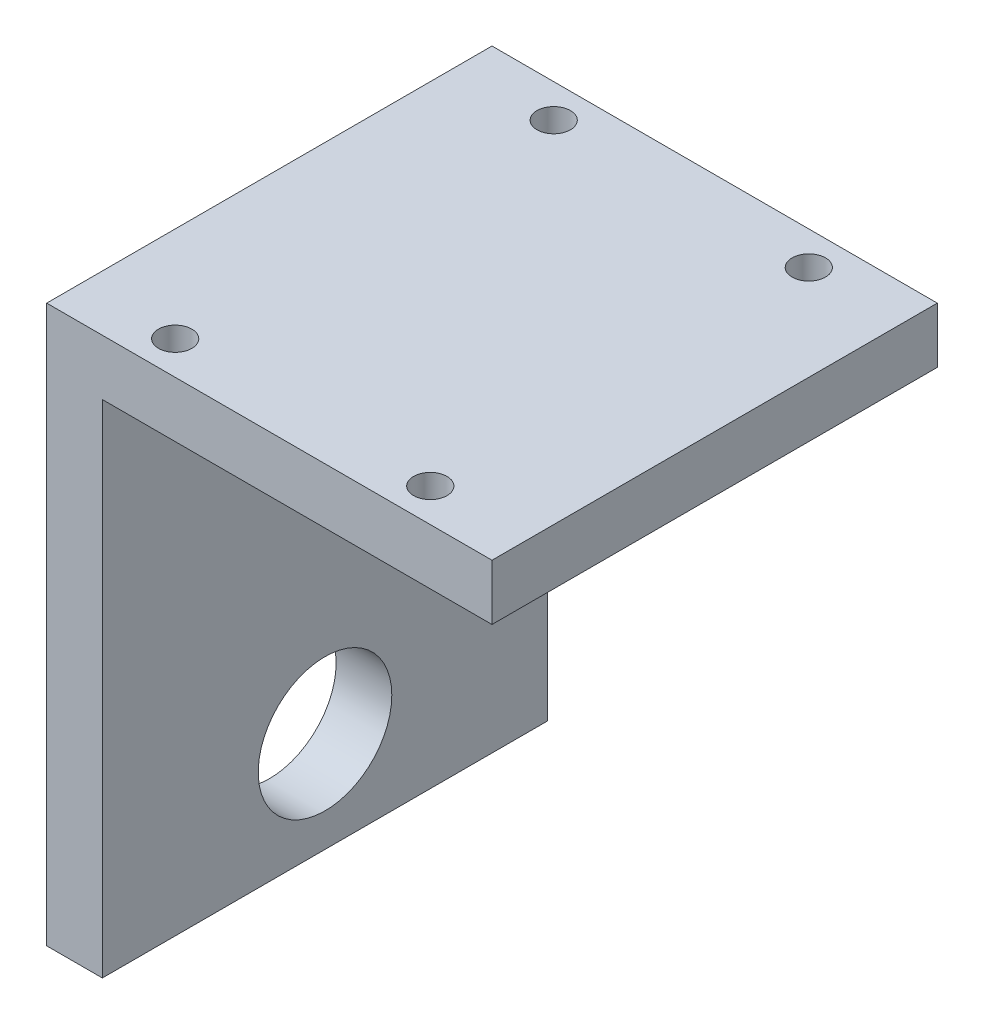
from build123d import *

# Parameters (mm, degrees)
SKETCH1_W           = 40
SKETCH1_H           = 40
BOSS_EXTRUDE1_DEPTH = 5
SKETCH2_W           = 5
SKETCH2_H           = 40
BOSS_EXTRUDE4_DEPTH = 45
SKETCH6_R           = 6
CUT_EXTRUDE5_DEPTH  = 61.415229868
SKETCH7_R           = 1.5
CUT_EXTRUDE6_DEPTH  = 58.445626465


with BuildPart() as part:
    # Sketch1 → Boss-Extrude1 (new body)
    with BuildSketch(Plane(origin=(0, 0, 0), x_dir=(1, 0, 0), z_dir=(0, 1, 0))):
        Rectangle(SKETCH1_W, SKETCH1_H)
    extrude(amount=BOSS_EXTRUDE1_DEPTH)

    # Sketch2 → Boss-Extrude4 (add)
    with BuildSketch(Plane.XZ):
        with Locations((-17.5, 0)):
            Rectangle(SKETCH2_W, SKETCH2_H)
    extrude(amount=BOSS_EXTRUDE4_DEPTH)

    # Sketch6 → Cut-Extrude5 (cut, through all)
    with BuildSketch(Plane(origin=(-15, 0, 0), x_dir=(0, 0, -1), z_dir=(1, 0, 0))):
        with Locations((0, -36)):
            Circle(SKETCH6_R)
    extrude(amount=-CUT_EXTRUDE5_DEPTH, mode=Mode.SUBTRACT)

    # Sketch7 → Cut-Extrude6 (cut, through all)
    with BuildSketch(Plane(origin=(0, 5, 0), x_dir=(1, 0, 0), z_dir=(0, 1, 0))):
        with Locations(Location((-11.456996051, 17, 0), (0, 0, 270))):
            Circle(SKETCH7_R)
        with Locations(Location((11.456996051, 17, 0), (0, 0, 270))):
            Circle(SKETCH7_R)
        with Locations(Location((11.456996051, -17, 0), (0, 0, 270))):
            Circle(SKETCH7_R)
        with Locations(Location((-11.456996051, -17, 0), (0, 0, 270))):
            Circle(SKETCH7_R)
    extrude(amount=-CUT_EXTRUDE6_DEPTH, mode=Mode.SUBTRACT)


solid = part.part
